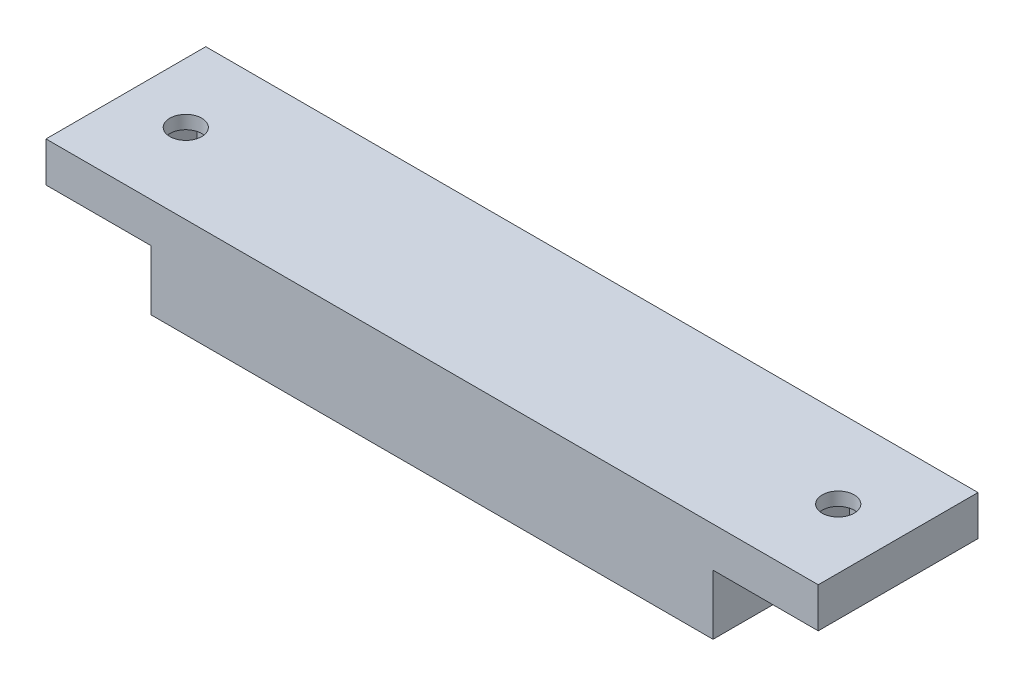
from build123d import *

# Parameters (mm, degrees)
SKETCH_1_W          = 42.2
SKETCH_1_H          = 12
EXTRUDE_1_DEPTH     = 6
CUT_EXTRUDE_1_DEPTH = 44.044628004
SKETCH_3_W          = 58
SKETCH_3_H          = 12
EXTRUDE_2_DEPTH     = 1.5
CUT_EXTRUDE_2_DEPTH = 2
CUT_EXTRUDE_3_REACH = 32.319
SKETCH_5_R          = 1.2


with BuildPart() as part:
    # 草图1 → 凸台-拉伸1 (new body)
    with BuildSketch(Plane(origin=(0, 0, 0), x_dir=(1, 0, 0), z_dir=(0, 1, 0))):
        Rectangle(SKETCH_1_W, SKETCH_1_H)
    extrude(amount=EXTRUDE_1_DEPTH)

    # 草图2 → 切除-拉伸1 (cut, through all)
    with BuildSketch(Plane(origin=(21.1, 0, 0), x_dir=(0, 0, -1), z_dir=(1, 0, 0))):
        Polygon((3.25, 3), (1.25, 0), (-1.25, 0), (-3.25, 3), align=None)
    extrude(amount=-CUT_EXTRUDE_1_DEPTH, mode=Mode.SUBTRACT)

    # 草图3 → 凸台-拉伸2 (add, symmetric)
    with BuildSketch(Plane(origin=(0, 6, 0), x_dir=(1, 0, 0), z_dir=(0, 1, 0))):
        Rectangle(SKETCH_3_W, SKETCH_3_H)
    extrude(amount=EXTRUDE_2_DEPTH, both=True)

    # 草图4 → 切除-拉伸2 (cut)
    with BuildSketch(Plane.XZ.offset(-4.5)):
        Polygon((-22.190598923, 0), (-23.345299462, 2), (-25.654700538, 2), (-26.809401077, 0), (-25.654700538, -2), (-23.345299462, -2), align=None)
        Polygon((22.190598923, 0), (23.345299462, 2), (25.654700538, 2), (26.809401077, 0), (25.654700538, -2), (23.345299462, -2), align=None)
    extrude(amount=-CUT_EXTRUDE_2_DEPTH, mode=Mode.SUBTRACT)

    # 草图5 → 切除-拉伸3 (cut, up to next)
    with BuildSketch(Plane.XZ.offset(-6.5), mode=Mode.PRIVATE) as cut_extrude_3_sk1:
        with Locations(Location((-24.5, 0, 0), (0, 0, 270))):
            Circle(SKETCH_5_R)
    cut_extrude_3_tool1 = extrude(cut_extrude_3_sk1.sketch, amount=-CUT_EXTRUDE_3_REACH, mode=Mode.PRIVATE) & part.part
    # 草图5 → 切除-拉伸3 (cut, up to next)
    with BuildSketch(Plane.XZ.offset(-6.5), mode=Mode.PRIVATE) as cut_extrude_3_sk2:
        with Locations(Location((24.5, 0, 0), (0, 0, 270))):
            Circle(SKETCH_5_R)
    cut_extrude_3_tool2 = extrude(cut_extrude_3_sk2.sketch, amount=-CUT_EXTRUDE_3_REACH, mode=Mode.PRIVATE) & part.part
    add(cut_extrude_3_tool1.solids().sort_by_distance((-24.5, 6.5, 0))[0], mode=Mode.SUBTRACT)
    add(cut_extrude_3_tool2.solids().sort_by_distance((24.5, 6.5, 0))[0], mode=Mode.SUBTRACT)


solid = part.part
